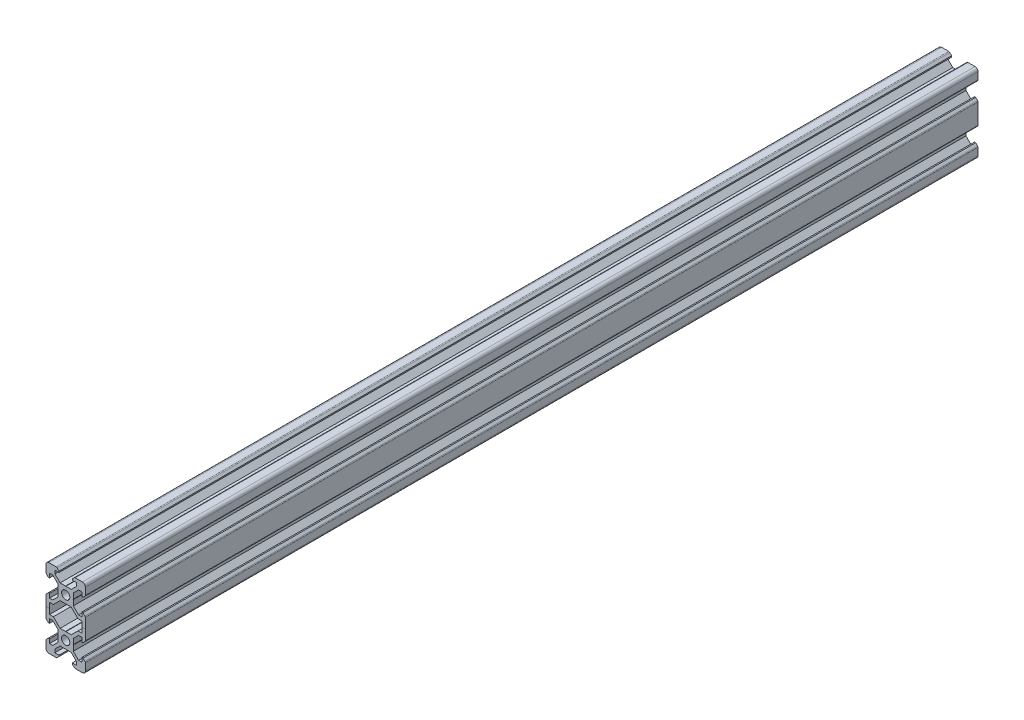
from build123d import *

# Parameters (mm, degrees)
SKETCH1_R           = 2.1
BOSS_EXTRUDE2_DEPTH = 454


with BuildPart() as part:
    # Sketch1 → Boss-Extrude2 (new body)
    with BuildSketch(Plane.XY):
        with BuildLine():
            Line((-8.5, 10), (-4.862792737, 10))
            ThreePointArc((-4.862792737, 10), (-4.598292737, 9.947387679), (-4.374060464, 9.797560464))
            Line((-4.374060464, 9.797560464), (-3.3865, 8.81))
            Line((-3.3865, 8.81), (-3.3865, 8.2))
            Line((-3.3865, 8.2), (-5.5, 8.2))
            Line((-5.5, 8.2), (-5.5, 6.561))
            Line((-5.5, 6.561), (-2.8395, 3.9005))
            Line((-2.8395, 3.9005), (-0.1, 3.9005))
            Line((-0.1, 3.9005), (0, 3.8005))
            Line((0, 3.8005), (0.1, 3.9005))
            Line((0.1, 3.9005), (2.8395, 3.9005))
            Line((2.8395, 3.9005), (5.5, 6.561))
            Line((5.5, 6.561), (5.5, 8.2))
            Line((5.5, 8.2), (3.3865, 8.2))
            Line((3.3865, 8.2), (3.3865, 8.81))
            Line((3.3865, 8.81), (4.374060464, 9.797560464))
            ThreePointArc((4.374060464, 9.797560464), (4.598292737, 9.947387679), (4.862792737, 10))
            Line((4.862792737, 10), (8.5, 10))
            ThreePointArc((8.5, 10), (9.560660172, 9.560660172), (10, 8.5))
            Line((10, 8.5), (10, 4.862792737))
            ThreePointArc((10, 4.862792737), (9.947387679, 4.598292737), (9.797560464, 4.374060464))
            Line((9.797560464, 4.374060464), (8.81, 3.3865))
            Line((8.81, 3.3865), (8.2, 3.3865))
            Line((8.2, 3.3865), (8.2, 5.5))
            Line((8.2, 5.5), (6.561, 5.5))
            Line((6.561, 5.5), (3.9005, 2.8395))
            Line((3.9005, 2.8395), (3.9005, 0.1))
            Line((3.9005, 0.1), (3.8005, 0))
            Line((3.8005, 0), (3.9005, -0.1))
            Line((3.9005, -0.1), (3.9005, -2.8395))
            Line((3.9005, -2.8395), (6.561, -5.5))
            Line((6.561, -5.5), (8.2, -5.5))
            Line((8.2, -5.5), (8.2, -3.3865))
            Line((8.2, -3.3865), (8.81, -3.3865))
            Line((8.81, -3.3865), (9.797560464, -4.374060464))
            ThreePointArc((9.797560464, -4.374060464), (9.947387679, -4.598292737), (10, -4.862792737))
            Line((10, -4.862792737), (10, -15.137207263))
            ThreePointArc((10, -15.137207263), (9.947387679, -15.401707263), (9.797560464, -15.625939536))
            Line((9.797560464, -15.625939536), (8.81, -16.6135))
            Line((8.81, -16.6135), (8.2, -16.6135))
            Line((8.2, -16.6135), (8.2, -14.5))
            Line((8.2, -14.5), (6.561, -14.5))
            Line((6.561, -14.5), (3.9005, -17.1605))
            Line((3.9005, -17.1605), (3.9005, -19.9))
            Line((3.9005, -19.9), (3.8005, -20))
            Line((3.8005, -20), (3.9005, -20.1))
            Line((3.9005, -20.1), (3.9005, -22.8395))
            Line((3.9005, -22.8395), (6.561, -25.5))
            Line((6.561, -25.5), (8.2, -25.5))
            Line((8.2, -25.5), (8.2, -23.3865))
            Line((8.2, -23.3865), (8.81, -23.3865))
            Line((8.81, -23.3865), (9.797560464, -24.374060464))
            ThreePointArc((9.797560464, -24.374060464), (9.947387679, -24.598292737), (10, -24.862792737))
            Line((10, -24.862792737), (10, -28.5))
            ThreePointArc((10, -28.5), (9.560660172, -29.560660172), (8.5, -30))
            Line((8.5, -30), (4.862792737, -30))
            ThreePointArc((4.862792737, -30), (4.598292737, -29.947387679), (4.374060464, -29.797560464))
            Line((4.374060464, -29.797560464), (3.3865, -28.81))
            Line((3.3865, -28.81), (3.3865, -28.2))
            Line((3.3865, -28.2), (5.5, -28.2))
            Line((5.5, -28.2), (5.5, -26.561))
            Line((5.5, -26.561), (2.8395, -23.9005))
            Line((2.8395, -23.9005), (0.1, -23.9005))
            Line((0.1, -23.9005), (0, -23.8005))
            Line((0, -23.8005), (-0.1, -23.9005))
            Line((-0.1, -23.9005), (-2.8395, -23.9005))
            Line((-2.8395, -23.9005), (-5.5, -26.561))
            Line((-5.5, -26.561), (-5.5, -28.2))
            Line((-5.5, -28.2), (-3.3865, -28.2))
            Line((-3.3865, -28.2), (-3.3865, -28.81))
            Line((-3.3865, -28.81), (-4.374060464, -29.797560464))
            ThreePointArc((-4.374060464, -29.797560464), (-4.598292737, -29.947387679), (-4.862792737, -30))
            Line((-4.862792737, -30), (-8.5, -30))
            ThreePointArc((-8.5, -30), (-9.560660172, -29.560660172), (-10, -28.5))
            Line((-10, -28.5), (-10, -24.862792737))
            ThreePointArc((-10, -24.862792737), (-9.947387679, -24.598292737), (-9.797560464, -24.374060464))
            Line((-9.797560464, -24.374060464), (-8.81, -23.3865))
            Line((-8.81, -23.3865), (-8.2, -23.3865))
            Line((-8.2, -23.3865), (-8.2, -25.5))
            Line((-8.2, -25.5), (-6.561, -25.5))
            Line((-6.561, -25.5), (-3.9005, -22.8395))
            Line((-3.9005, -22.8395), (-3.9005, -20.1))
            Line((-3.9005, -20.1), (-3.8005, -20))
            Line((-3.8005, -20), (-3.9005, -19.9))
            Line((-3.9005, -19.9), (-3.9005, -17.1605))
            Line((-3.9005, -17.1605), (-6.561, -14.5))
            Line((-6.561, -14.5), (-8.2, -14.5))
            Line((-8.2, -14.5), (-8.2, -16.6135))
            Line((-8.2, -16.6135), (-8.81, -16.6135))
            Line((-8.81, -16.6135), (-9.797560464, -15.625939536))
            ThreePointArc((-9.797560464, -15.625939536), (-9.947387679, -15.401707263), (-10, -15.137207263))
            Line((-10, -15.137207263), (-10, -4.862792737))
            ThreePointArc((-10, -4.862792737), (-9.947387679, -4.598292737), (-9.797560464, -4.374060464))
            Line((-9.797560464, -4.374060464), (-8.81, -3.3865))
            Line((-8.81, -3.3865), (-8.2, -3.3865))
            Line((-8.2, -3.3865), (-8.2, -5.5))
            Line((-8.2, -5.5), (-6.561, -5.5))
            Line((-6.561, -5.5), (-3.9005, -2.8395))
            Line((-3.9005, -2.8395), (-3.9005, -0.1))
            Line((-3.9005, -0.1), (-3.8005, 0))
            Line((-3.8005, 0), (-3.9005, 0.1))
            Line((-3.9005, 0.1), (-3.9005, 2.8395))
            Line((-3.9005, 2.8395), (-6.561, 5.5))
            Line((-6.561, 5.5), (-8.2, 5.5))
            Line((-8.2, 5.5), (-8.2, 3.3865))
            Line((-8.2, 3.3865), (-8.81, 3.3865))
            Line((-8.81, 3.3865), (-9.797560464, 4.374060464))
            ThreePointArc((-9.797560464, 4.374060464), (-9.947387679, 4.598292737), (-10, 4.862792737))
            Line((-10, 4.862792737), (-10, 8.5))
            ThreePointArc((-10, 8.5), (-9.560660172, 9.560660172), (-8.5, 10))
        make_face()
        with Locations(Location((0, 0, 0), (0, 0, 180))):
            Circle(SKETCH1_R, mode=Mode.SUBTRACT)
        with Locations(Location((0, -20, 0), (0, 0, 180))):
            Circle(SKETCH1_R, mode=Mode.SUBTRACT)
        Polygon((-8.2, -12.7), (-8.2, -7.3), (-6.239, -7.3), (-5.5, -6.561), (-2.8395, -3.9005), (-0.1, -3.9005), (0, -3.8005), (0.1, -3.9005), (2.8395, -3.9005), (5.5, -6.561), (6.239, -7.3), (8.2, -7.3), (8.2, -12.7), (6.239, -12.7), (5.5, -13.439), (2.8395, -16.0995), (0.1, -16.0995), (0, -16.1995), (-0.1, -16.0995), (-2.8395, -16.0995), (-5.5, -13.439), (-6.239, -12.7), align=None, mode=Mode.SUBTRACT)
    extrude(amount=BOSS_EXTRUDE2_DEPTH)


solid = part.part
